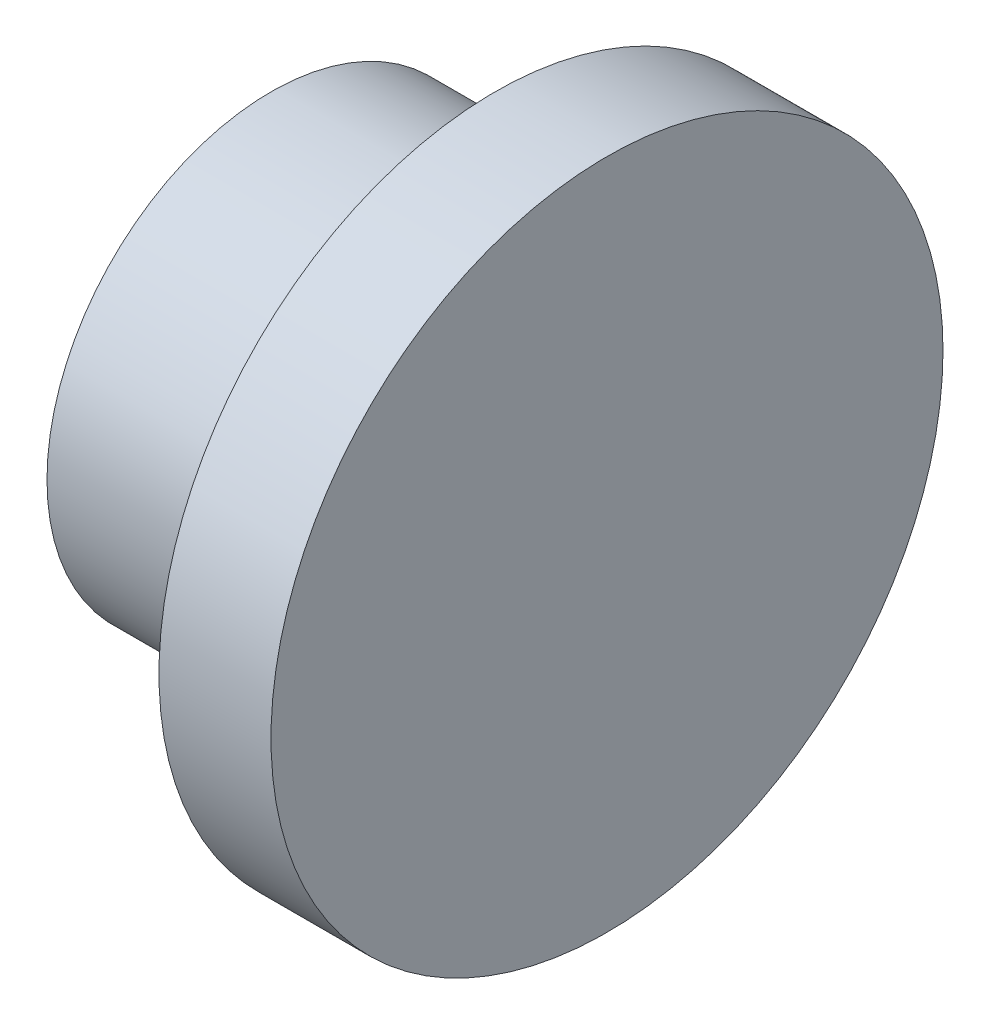
from build123d import *

# Parameters (mm, degrees)
SKETCH1_R           = 15
BOSS_EXTRUDE1_DEPTH = 5
SKETCH2_R           = 10
BOSS_EXTRUDE2_DEPTH = 10
SKETCH3_R           = 5
CUT_EXTRUDE1_DEPTH  = 10


with BuildPart() as part:
    # Sketch1 → Boss-Extrude1 (new body)
    with BuildSketch(Plane(origin=(0, 0, 0), x_dir=(0, 0, -1), z_dir=(1, 0, 0))):
        Circle(SKETCH1_R)
    extrude(amount=BOSS_EXTRUDE1_DEPTH)

    # Sketch2 → Boss-Extrude2 (add)
    with BuildSketch(Plane.ZY):
        Circle(SKETCH2_R)
    extrude(amount=BOSS_EXTRUDE2_DEPTH)

    # Sketch3 → Cut-Extrude1 (cut)
    with BuildSketch(Plane.ZY.offset(10)):
        Circle(SKETCH3_R)
    extrude(amount=-CUT_EXTRUDE1_DEPTH, mode=Mode.SUBTRACT)


solid = part.part
